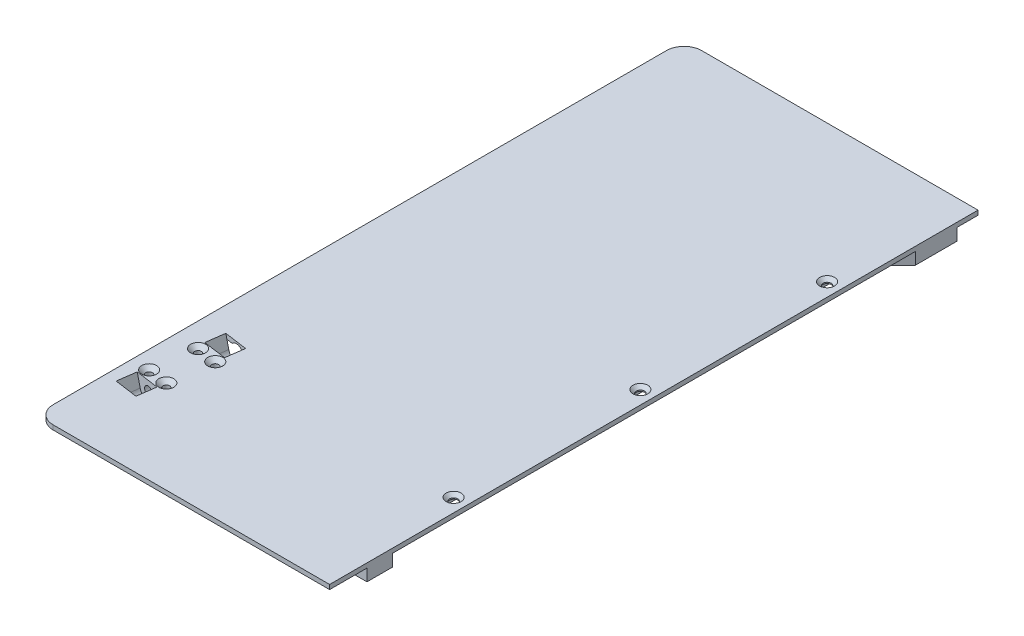
from build123d import *

# Parameters (mm, degrees)
BOSS_EXTRUDE1_DEPTH = 1.2
SKETCH4_W           = 62.7
SKETCH4_H           = 158
BOSS_EXTRUDE3_DEPTH = 3.2
SKETCH6_W           = 13.5
SKETCH6_H           = 11.65
SKETCH6_R           = 1.1
SKETCH6_H_2         = 29.2
BOSS_EXTRUDE4_DEPTH = 5.1
SKETCH7_W           = 0.1
SKETCH7_H           = 11.65
SKETCH7_H_2         = 29.2
BOSS_EXTRUDE5_DEPTH = 3.2
CUT_EXTRUDE5_DEPTH  = 5.1
CUT_EXTRUDE6_DEPTH  = 5.2
SKETCH11_R          = 1.2
CUT_EXTRUDE7_DEPTH  = 5.4
CUT_EXTRUDE8_DEPTH  = 5
BOSS_EXTRUDE6_DEPTH = 5
CUT_EXTRUDE9_DEPTH  = 5
BOSS_EXTRUDE7_START = 5
BOSS_EXTRUDE7_DEPTH = 5
SKETCH20_W          = 8
SKETCH20_H          = 7.2
CUT_EXTRUDE10_DEPTH = 3.6
CUT_EXTRUDE12_DEPTH = 1.8
CUT_EXTRUDE13_START = -5.4
SKETCH23_R          = 1.2
CUT_EXTRUDE13_DEPTH = 5.4
SKETCH24_R          = 0.9
CUT_EXTRUDE14_DEPTH = 96.780634786
CHAMFER1_SIZE       = 1.1
SKETCH26_R          = 2
CUT_EXTRUDE15_DEPTH = 12
CUT_EXTRUDE16_START = 12
SKETCH27_R          = 2
CUT_EXTRUDE16_DEPTH = 12
CUT_EXTRUDE17_START = -3.6
CUT_EXTRUDE17_DEPTH = 1.8
CUT_EXTRUDE18_REACH = 97.781
SKETCH29_W          = 6.8
SKETCH29_H          = 6.1
CUT_EXTRUDE19_DEPTH = 3.2
CUT_EXTRUDE20_REACH = 97.781
SKETCH32_R          = 1.1
CHAMFER2_SIZE       = 0.9


with BuildPart() as part:
    # Sketch1 → Boss-Extrude1 (new body)
    with BuildSketch(Plane(origin=(0, 0, 0), x_dir=(1, 0, 0), z_dir=(0, 1, 0))):
        with BuildLine():
            Line((40, 86.8), (-34, 86.8))
            ThreePointArc((-34, 86.8), (-37.323401872, 85.423401872), (-38.7, 82.1))
            Line((-38.7, 82.1), (-38.7, -82.1))
            ThreePointArc((-38.7, -82.1), (-37.323401872, -85.423401872), (-34, -86.8))
            Line((-34, -86.8), (40, -86.8))
            Line((40, -86.8), (40, 86.8))
        make_face()
    extrude(amount=-BOSS_EXTRUDE1_DEPTH)

    # Sketch4 → Boss-Extrude3 (add)
    with BuildSketch(Plane(origin=(0, -1.2, 0), x_dir=(-1, 0, 0), z_dir=(0, -1, 0))):
        with Locations((-8.65, 2.2)):
            Rectangle(SKETCH4_W, SKETCH4_H)
    extrude(amount=BOSS_EXTRUDE3_DEPTH)

    # Sketch6 → Boss-Extrude4 (add)
    # profile 1 of 2: a face of its own
    with BuildSketch(Plane.XZ.offset(1.2)):
        with Locations((-29.55, -70.575)):
            Rectangle(SKETCH6_W, SKETCH6_H)
        with Locations(Location((-25.5, -68.35, 0), (0, 0, 270))):
            Circle(SKETCH6_R, mode=Mode.SUBTRACT)
    # profile 2 of 2: a face of its own
    with BuildSketch(Plane.XZ.offset(1.2)):
        with Locations((-29.55, 56.05)):
            Rectangle(SKETCH6_W, SKETCH6_H_2)
        with Locations(Location((-25.5, 56.05, 0), (0, 0, 270))):
            Circle(SKETCH6_R, mode=Mode.SUBTRACT)
    extrude(amount=BOSS_EXTRUDE4_DEPTH)

    # Sketch7 → Boss-Extrude5 (add)
    with BuildSketch(Plane.XZ.offset(1.2)):
        with Locations((-22.75, -70.575)):
            Rectangle(SKETCH7_W, SKETCH7_H)
        with Locations((-22.75, 56.05)):
            Rectangle(SKETCH7_W, SKETCH7_H_2)
    extrude(amount=BOSS_EXTRUDE5_DEPTH)

    # Sketch10 → Cut-Extrude5 (cut)
    with BuildSketch(Plane.XZ.offset(6.3)):
        Polygon((-25.959839262, 43.33044604), (-25.695559806, 41.45), (-39.339908081, 41.45), align=None)
        Polygon((-29.578339887, 69.077415827), (-29.79935218, 70.65), (-36.3, 70.65), (-36.3, 68.132748105), align=None)
    extrude(amount=-CUT_EXTRUDE5_DEPTH, mode=Mode.SUBTRACT)

    # Sketch9 → Cut-Extrude6 (cut)
    with BuildSketch(Plane(origin=(0, 0, 0), x_dir=(1, 0, 0), z_dir=(0, 1, 0))):
        Polygon((-34.925787458, -68.325881082), (-34.229921954, -63.374540738), (-28.882474382, -64.126075484), (-29.578339887, -69.077415827), align=None)
        Polygon((-25.959839262, -43.33044604), (-31.307286833, -42.578911295), (-32.003152338, -47.530251639), (-26.655704767, -48.281786384), align=None)
    extrude(amount=-CUT_EXTRUDE6_DEPTH, mode=Mode.SUBTRACT)

    # Sketch11 → Cut-Extrude7 (cut)
    with BuildSketch(Plane(origin=(-9.39719998, 0, 66.864552213), x_dir=(0.9902680687415714, 0, 0.13917310096005855), z_dir=(-0.13917310096005855, 0, 0.9902680687415714))):
        with Locations((-22.37676735, -2.5)):
            Circle(SKETCH11_R)
    extrude(amount=-CUT_EXTRUDE7_DEPTH, mode=Mode.SUBTRACT)

    # Sketch15 → Cut-Extrude8 (cut)
    with BuildSketch(Plane(origin=(-9.39719998, 0, 66.864552213), x_dir=(0.9902680687415714, 0, 0.13917310096005855), z_dir=(-0.13917310096005855, 0, 0.9902680687415714))):
        Polygon((-25.902439291, 0), (-25.07676735, 0), (-25.07676735, -2.879460254), align=None)
    extrude(amount=CUT_EXTRUDE8_DEPTH, mode=Mode.SUBTRACT)

    # Sketch17 → Boss-Extrude6 (add)
    with BuildSketch(Plane(origin=(-9.39719998, 0, 66.864552213), x_dir=(0.9902680687415714, 0, 0.13917310096005855), z_dir=(-0.13917310096005855, 0, 0.9902680687415714))):
        with BuildLine():
            Line((-25.07676735, -2.879460254), (-24.972173929, -3.244220861))
            ThreePointArc((-24.972173929, -3.244220861), (-22.000999977, -5.173723786), (-19.67676735, -2.5))
            Line((-19.67676735, -2.5), (-19.67676735, -6.3))
            Line((-19.67676735, -6.3), (-25.07676735, -6.3))
            Line((-25.07676735, -6.3), (-25.07676735, -2.879460254))
        make_face()
    extrude(amount=BOSS_EXTRUDE6_DEPTH)

    # Sketch18 → Cut-Extrude9 (cut)
    with BuildSketch(Plane(origin=(-7.170430365, 0, 51.020263113), x_dir=(-0.9902680687415715, 0, -0.13917310096005736), z_dir=(0.13917310096005736, 0, -0.9902680687415715))):
        Polygon((25.902439291, 0), (25.07676735, 0), (25.07676735, -2.879460254), align=None)
    extrude(amount=CUT_EXTRUDE9_DEPTH, mode=Mode.SUBTRACT)

    # Sketch19 → Boss-Extrude7 (add)
    with BuildSketch(Plane(origin=(-7.170430365, 0, 51.020263113), x_dir=(-0.9902680687415715, 0, -0.13917310096005736), z_dir=(0.13917310096005736, 0, -0.9902680687415715)).offset(BOSS_EXTRUDE7_START)):
        with BuildLine():
            Line((25.07676735, -2.879460254), (24.972173929, -3.244220861))
            ThreePointArc((24.972173929, -3.244220861), (22.000999977, -5.173723786), (19.67676735, -2.5))
            Line((19.67676735, -2.5), (19.67676735, -6.3))
            Line((19.67676735, -6.3), (25.07676735, -6.3))
            Line((25.07676735, -6.3), (25.07676735, -2.879460254))
        make_face()
    extrude(amount=-BOSS_EXTRUDE7_DEPTH)

    # Sketch20 → Cut-Extrude10 (cut)
    with BuildSketch(Plane.XZ.offset(6.3)):
        with Locations((-32.3, 56.05)):
            Rectangle(SKETCH20_W, SKETCH20_H)
    extrude(amount=-CUT_EXTRUDE10_DEPTH, mode=Mode.SUBTRACT)

    # Sketch22 → Cut-Extrude12 (cut)
    with BuildSketch(Plane(origin=(0, -2.7, 0), x_dir=(-1, 0, 0), z_dir=(0, -1, 0))):
        Polygon((24.056624327, -58.55), (26.943375673, -58.55), (28.3, -58.55), (28.3, -53.55), (26.943375673, -53.55), (24.056624327, -53.55), (22.613248654, -56.05), align=None)
    extrude(amount=CUT_EXTRUDE12_DEPTH, mode=Mode.SUBTRACT)

    # Sketch23 → Cut-Extrude13 (cut)
    with BuildSketch(Plane(origin=(-7.170430365, 0, 51.020263113), x_dir=(-0.9902680687415715, 0, -0.13917310096005736), z_dir=(0.13917310096005736, 0, -0.9902680687415715)).offset(CUT_EXTRUDE13_START)):
        with Locations(Location((22.37676735, -2.5, 0), (0, 0, 180))):
            Circle(SKETCH23_R)
    extrude(amount=CUT_EXTRUDE13_DEPTH, mode=Mode.SUBTRACT)

    # Sketch24 → Cut-Extrude14 (cut, through all)
    with BuildSketch(Plane(origin=(0, 0, 0), x_dir=(1, 0, 0), z_dir=(0, 1, 0))):
        with Locations(Location((-32.30933316, -49.70884139, 0), (0, 0, 270))):
            Circle(SKETCH24_R)
        with Locations(Location((-26.961885589, -50.460376135, 0), (0, 0, 270))):
            Circle(SKETCH24_R)
        with Locations(Location((-28.57629356, -61.947485732, 0), (0, 0, 270))):
            Circle(SKETCH24_R)
        with Locations(Location((-33.923741132, -61.195950987, 0), (0, 0, 270))):
            Circle(SKETCH24_R)
    extrude(amount=-CUT_EXTRUDE14_DEPTH, mode=Mode.SUBTRACT)

    # Chamfer1
    chamfer1_edges = [part.edges().sort_by_distance(p)[0] for p in [
        (-32.30933316, 0, 48.80884139),
        (-33.923741132, 0, 60.295950987),
        (-28.57629356, 0, 61.047485732),
        (-26.961885589, 0, 49.560376135),
    ]]
    chamfer(chamfer1_edges, length=CHAMFER1_SIZE)

    # Sketch26 → Cut-Extrude15 (cut)
    with BuildSketch(Plane(origin=(-6.47456486, 0, 46.068922769), x_dir=(-0.9902680687415714, 0, -0.13917310096005867), z_dir=(0.13917310096005867, 0, -0.9902680687415714))):
        with Locations((22.37676735, -2.5)):
            Circle(SKETCH26_R)
    extrude(amount=CUT_EXTRUDE15_DEPTH, mode=Mode.SUBTRACT)

    # Sketch27 → Cut-Extrude16 (cut)
    with BuildSketch(Plane(origin=(-10.093065485, 0, 71.815892556), x_dir=(0.9902680687415714, 0, 0.1391731009600588), z_dir=(-0.1391731009600588, 0, 0.9902680687415714)).offset(CUT_EXTRUDE16_START)):
        with Locations((-22.37676735, -2.5)):
            Circle(SKETCH27_R)
    extrude(amount=-CUT_EXTRUDE16_DEPTH, mode=Mode.SUBTRACT)

    # Sketch28 → Cut-Extrude17 (cut)
    with BuildSketch(Plane.XZ.offset(6.3).offset(CUT_EXTRUDE17_START)):
        Polygon((-26.943375673, -70.85), (-24.056624327, -70.85), (-22.613248654, -68.35), (-24.056624327, -65.85), (-26.943375673, -65.85), (-28.386751346, -65.85), (-28.386751346, -64.75), (-35.186751346, -64.75), (-35.186751346, -70.85), align=None)
    extrude(amount=CUT_EXTRUDE17_DEPTH, mode=Mode.SUBTRACT)

    # Sketch29 → Cut-Extrude18 (cut, up to next)
    with BuildSketch(Plane.XZ.offset(6.3), mode=Mode.PRIVATE) as cut_extrude18_sk1:
        with Locations((-31.786751346, -67.8)):
            Rectangle(SKETCH29_W, SKETCH29_H)
    cut_extrude18_tool1 = extrude(cut_extrude18_sk1.sketch, amount=-CUT_EXTRUDE18_REACH, mode=Mode.PRIVATE) & part.part
    add(cut_extrude18_tool1.solids().sort_by_distance((-31.786751, -6.3, -67.8))[0], mode=Mode.SUBTRACT)

    # Sketch31 → Cut-Extrude19 (cut)
    with BuildSketch(Plane.XZ.offset(4.4)):
        Polygon((40, 70), (32.8, 62.8), (32.8, -62.8), (40, -70), align=None)
    extrude(amount=-CUT_EXTRUDE19_DEPTH, mode=Mode.SUBTRACT)

    # Sketch32 → Cut-Extrude20 (cut, up to next)
    with BuildSketch(Plane(origin=(0, 0, 0), x_dir=(1, 0, 0), z_dir=(0, 1, 0)), mode=Mode.PRIVATE) as cut_extrude20_sk1:
        with Locations(Location((36.4, 50, 0), (0, 0, 270))):
            Circle(SKETCH32_R)
    cut_extrude20_tool1 = extrude(cut_extrude20_sk1.sketch, amount=-CUT_EXTRUDE20_REACH, mode=Mode.PRIVATE) & part.part
    # Sketch32 → Cut-Extrude20 (cut, up to next)
    with BuildSketch(Plane(origin=(0, 0, 0), x_dir=(1, 0, 0), z_dir=(0, 1, 0)), mode=Mode.PRIVATE) as cut_extrude20_sk2:
        with Locations(Location((36.4, 0, 0), (0, 0, 270))):
            Circle(SKETCH32_R)
    cut_extrude20_tool2 = extrude(cut_extrude20_sk2.sketch, amount=-CUT_EXTRUDE20_REACH, mode=Mode.PRIVATE) & part.part
    # Sketch32 → Cut-Extrude20 (cut, up to next)
    with BuildSketch(Plane(origin=(0, 0, 0), x_dir=(1, 0, 0), z_dir=(0, 1, 0)), mode=Mode.PRIVATE) as cut_extrude20_sk3:
        with Locations(Location((36.4, -50, 0), (0, 0, 270))):
            Circle(SKETCH32_R)
    cut_extrude20_tool3 = extrude(cut_extrude20_sk3.sketch, amount=-CUT_EXTRUDE20_REACH, mode=Mode.PRIVATE) & part.part
    add(cut_extrude20_tool1.solids().sort_by_distance((36.4, 0, -50))[0], mode=Mode.SUBTRACT)
    add(cut_extrude20_tool2.solids().sort_by_distance((36.4, 0, 0))[0], mode=Mode.SUBTRACT)
    add(cut_extrude20_tool3.solids().sort_by_distance((36.4, 0, 50))[0], mode=Mode.SUBTRACT)

    # Chamfer2
    chamfer2_edges = [part.edges().sort_by_distance(p)[0] for p in [
        (36.4, 0, -51.1),
        (36.4, 0, -1.1),
        (36.4, 0, 48.9),
    ]]
    chamfer(chamfer2_edges, length=CHAMFER2_SIZE)


solid = part.part
